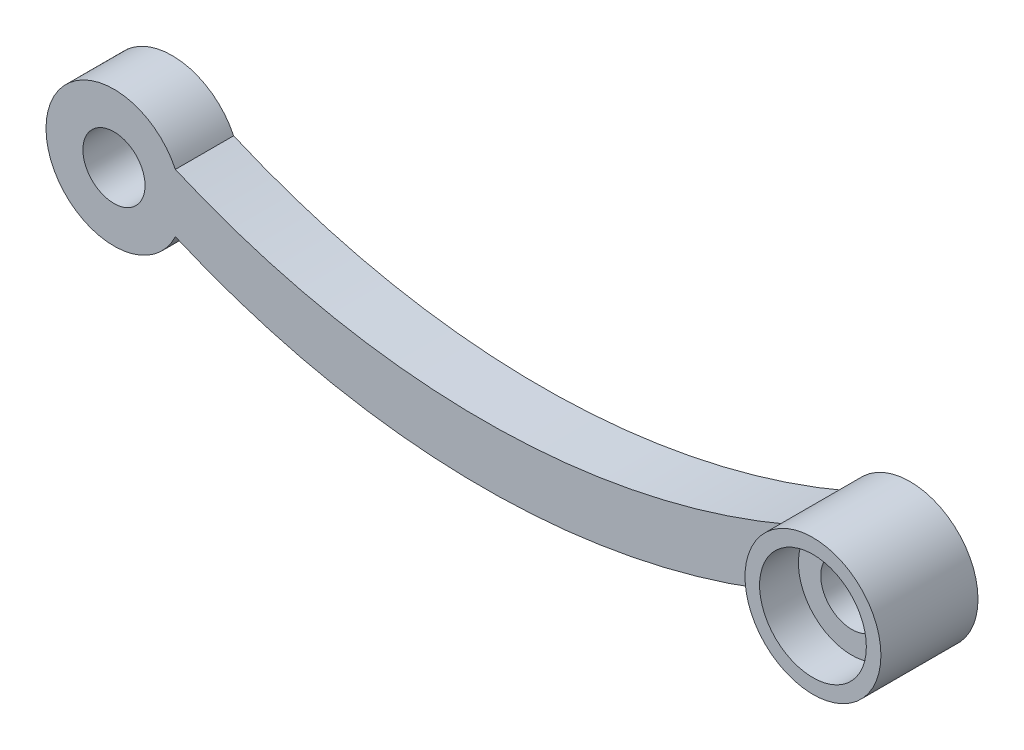
from build123d import *

# Parameters (mm, degrees)
SKETCH2_R           = 1.6
BOSS_EXTRUDE1_DEPTH = 3
SKETCH3_R           = 3.5
SKETCH3_R_2         = 2.75
BOSS_EXTRUDE2_DEPTH = 2


with BuildPart() as part:
    # Sketch2 → Boss-Extrude1 (new body)
    with BuildSketch(Plane.XY):
        with BuildLine():
            ThreePointArc((-15.83772234, 1.5), (-22.5, 0), (-15.83772234, -1.5))
            ThreePointArc((-15.83772234, -1.5), (0, -4.768997412), (15.83772234, -1.5))
            ThreePointArc((15.83772234, -1.5), (22.5, 0), (15.83772234, 1.5))
            ThreePointArc((15.83772234, 1.5), (0, -1.768997412), (-15.83772234, 1.5))
        make_face()
        with Locations((-19, 0)):
            Circle(SKETCH2_R, mode=Mode.SUBTRACT)
        with Locations((19, 0)):
            Circle(SKETCH2_R, mode=Mode.SUBTRACT)
    extrude(amount=BOSS_EXTRUDE1_DEPTH)

    # Sketch3 → Boss-Extrude2 (add)
    with BuildSketch(Plane.XY.offset(3)):
        with Locations(Location((19, 0, 0), (0, 0, 154.623066475))):
            Circle(SKETCH3_R)
        with Locations((19, 0)):
            Circle(SKETCH3_R_2, mode=Mode.SUBTRACT)
    extrude(amount=BOSS_EXTRUDE2_DEPTH)


solid = part.part
